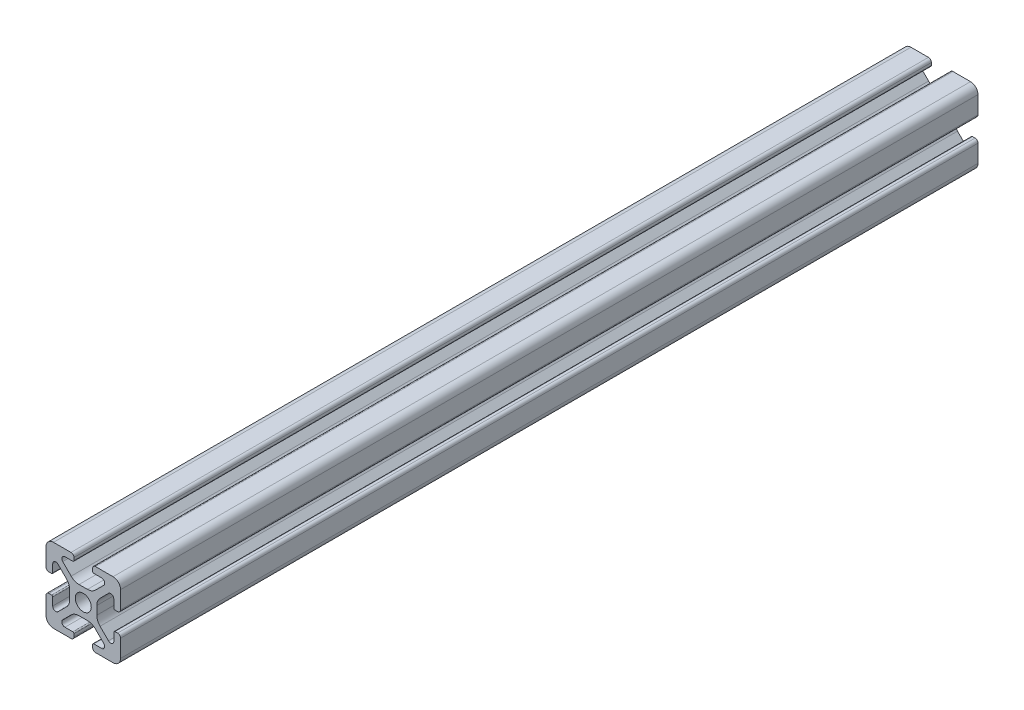
from build123d import *

# Parameters (mm, degrees)
SKETCH1_R           = 2.1463
BOSS_EXTRUDE1_DEPTH = 115


with BuildPart() as part:
    # Sketch1 → Boss-Extrude1 (new, symmetric)
    with BuildSketch(Plane.XY):
        with BuildLine():
            Line((-9.9949, 7.9883), (-9.9949, 3.2893))
            ThreePointArc((-9.9949, 3.2893), (-9.76427588, 2.73252412), (-9.2075, 2.5019))
            Line((-9.2075, 2.5019), (-8.4963, 2.5019))
            ThreePointArc((-8.4963, 2.5019), (-8.280773853, 2.591173853), (-8.1915, 2.8067))
            Line((-8.1915, 2.8067), (-8.1915, 4.9149))
            ThreePointArc((-8.1915, 4.9149), (-7.674065253, 5.689295824), (-6.760603096, 5.507596904))
            Line((-6.760603096, 5.507596904), (-4.505765747, 3.252759555))
            ThreePointArc((-4.505765747, 3.252759555), (-3.856054457, 2.280397894), (-3.627906192, 1.133419111))
            Line((-3.627906192, 1.133419111), (-3.627906192, -1.133419111))
            ThreePointArc((-3.627906192, -1.133419111), (-3.856054457, -2.280397894), (-4.505765747, -3.252759555))
            Line((-4.505765747, -3.252759555), (-6.760603096, -5.507596904))
            ThreePointArc((-6.760603096, -5.507596904), (-7.674065253, -5.689295824), (-8.1915, -4.9149))
            Line((-8.1915, -4.9149), (-8.1915, -2.8067))
            ThreePointArc((-8.1915, -2.8067), (-8.280773853, -2.591173853), (-8.4963, -2.5019))
            Line((-8.4963, -2.5019), (-9.2075, -2.5019))
            ThreePointArc((-9.2075, -2.5019), (-9.76427588, -2.73252412), (-9.9949, -3.2893))
            Line((-9.9949, -3.2893), (-9.9949, -7.9883))
            ThreePointArc((-9.9949, -7.9883), (-9.407180467, -9.407180467), (-7.9883, -9.9949))
            Line((-7.9883, -9.9949), (-3.2893, -9.9949))
            ThreePointArc((-3.2893, -9.9949), (-2.73252412, -9.76427588), (-2.5019, -9.2075))
            Line((-2.5019, -9.2075), (-2.5019, -8.4963))
            ThreePointArc((-2.5019, -8.4963), (-2.591173853, -8.280773853), (-2.8067, -8.1915))
            Line((-2.8067, -8.1915), (-4.9149, -8.1915))
            ThreePointArc((-4.9149, -8.1915), (-5.689295824, -7.674065253), (-5.507596904, -6.760603096))
            Line((-5.507596904, -6.760603096), (-3.252759555, -4.505765747))
            ThreePointArc((-3.252759555, -4.505765747), (-2.280397894, -3.856054457), (-1.133419111, -3.627906192))
            Line((-1.133419111, -3.627906192), (1.133419111, -3.627906192))
            ThreePointArc((1.133419111, -3.627906192), (2.280397894, -3.856054457), (3.252759555, -4.505765747))
            Line((3.252759555, -4.505765747), (5.507596904, -6.760603096))
            ThreePointArc((5.507596904, -6.760603096), (5.689295824, -7.674065253), (4.9149, -8.1915))
            Line((4.9149, -8.1915), (2.8067, -8.1915))
            ThreePointArc((2.8067, -8.1915), (2.591173853, -8.280773853), (2.5019, -8.4963))
            Line((2.5019, -8.4963), (2.5019, -9.2075))
            ThreePointArc((2.5019, -9.2075), (2.73252412, -9.76427588), (3.2893, -9.9949))
            Line((3.2893, -9.9949), (7.9883, -9.9949))
            ThreePointArc((7.9883, -9.9949), (9.407180467, -9.407180467), (9.9949, -7.9883))
            Line((9.9949, -7.9883), (9.9949, -3.2893))
            ThreePointArc((9.9949, -3.2893), (9.76427588, -2.73252412), (9.2075, -2.5019))
            Line((9.2075, -2.5019), (8.4963, -2.5019))
            ThreePointArc((8.4963, -2.5019), (8.280773853, -2.591173853), (8.1915, -2.8067))
            Line((8.1915, -2.8067), (8.1915, -4.9149))
            ThreePointArc((8.1915, -4.9149), (7.674065253, -5.689295824), (6.760603096, -5.507596904))
            Line((6.760603096, -5.507596904), (4.505765747, -3.252759555))
            ThreePointArc((4.505765747, -3.252759555), (3.856054457, -2.280397894), (3.627906192, -1.133419111))
            Line((3.627906192, -1.133419111), (3.627906192, 1.133419111))
            ThreePointArc((3.627906192, 1.133419111), (3.856054457, 2.280397894), (4.505765747, 3.252759555))
            Line((4.505765747, 3.252759555), (6.760603096, 5.507596904))
            ThreePointArc((6.760603096, 5.507596904), (7.674065253, 5.689295824), (8.1915, 4.9149))
            Line((8.1915, 4.9149), (8.1915, 2.8067))
            ThreePointArc((8.1915, 2.8067), (8.280773853, 2.591173853), (8.4963, 2.5019))
            Line((8.4963, 2.5019), (9.2075, 2.5019))
            ThreePointArc((9.2075, 2.5019), (9.76427588, 2.73252412), (9.9949, 3.2893))
            Line((9.9949, 3.2893), (9.9949, 7.9883))
            ThreePointArc((9.9949, 7.9883), (9.407180467, 9.407180467), (7.9883, 9.9949))
            Line((7.9883, 9.9949), (3.2893, 9.9949))
            ThreePointArc((3.2893, 9.9949), (2.73252412, 9.76427588), (2.5019, 9.2075))
            Line((2.5019, 9.2075), (2.5019, 8.4963))
            ThreePointArc((2.5019, 8.4963), (2.591173853, 8.280773853), (2.8067, 8.1915))
            Line((2.8067, 8.1915), (4.9149, 8.1915))
            ThreePointArc((4.9149, 8.1915), (5.689295824, 7.674065253), (5.507596904, 6.760603096))
            Line((5.507596904, 6.760603096), (3.252759555, 4.505765747))
            ThreePointArc((3.252759555, 4.505765747), (2.280397894, 3.856054457), (1.133419111, 3.627906192))
            Line((1.133419111, 3.627906192), (-1.133419111, 3.627906192))
            ThreePointArc((-1.133419111, 3.627906192), (-2.280397894, 3.856054457), (-3.252759555, 4.505765747))
            Line((-3.252759555, 4.505765747), (-5.507596904, 6.760603096))
            ThreePointArc((-5.507596904, 6.760603096), (-5.689295824, 7.674065253), (-4.9149, 8.1915))
            Line((-4.9149, 8.1915), (-2.8067, 8.1915))
            ThreePointArc((-2.8067, 8.1915), (-2.591173853, 8.280773853), (-2.5019, 8.4963))
            Line((-2.5019, 8.4963), (-2.5019, 9.2075))
            ThreePointArc((-2.5019, 9.2075), (-2.73252412, 9.76427588), (-3.2893, 9.9949))
            Line((-3.2893, 9.9949), (-7.9883, 9.9949))
            ThreePointArc((-7.9883, 9.9949), (-9.407180467, 9.407180467), (-9.9949, 7.9883))
        make_face()
        Circle(SKETCH1_R, mode=Mode.SUBTRACT)
    extrude(amount=BOSS_EXTRUDE1_DEPTH, both=True)


solid = part.part
